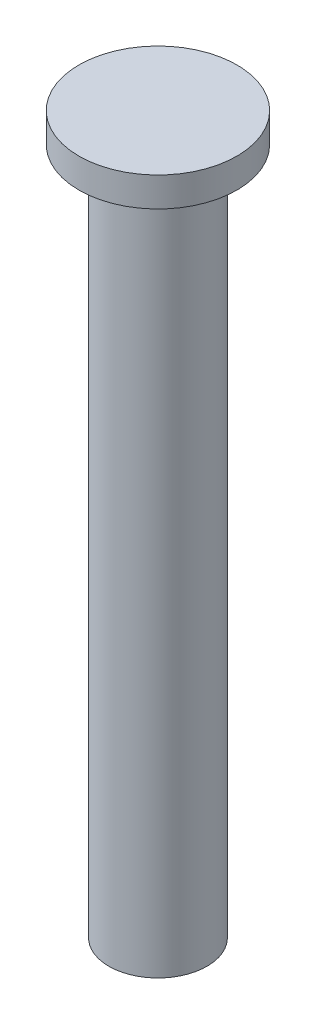
from build123d import *

# Parameters (mm, degrees)
SKETCH_1_R      = 2.5
EXTRUDE_1_DEPTH = 35
SKETCH_2_R      = 4.024551442
EXTRUDE_2_DEPTH = 1.5


with BuildPart() as part:
    # 草图1 → 凸台-拉伸1 (new body)
    with BuildSketch(Plane(origin=(0, 0, 0), x_dir=(1, 0, 0), z_dir=(0, 1, 0))):
        with Locations(Location((0, 0, 0), (0, 0, 270))):
            Circle(SKETCH_1_R)
    extrude(amount=EXTRUDE_1_DEPTH)

    # 草图2 → 凸台-拉伸2 (add)
    with BuildSketch(Plane(origin=(0, 35, 0), x_dir=(1, 0, 0), z_dir=(0, 1, 0))):
        with Locations(Location((0, 0, 0), (0, 0, 270))):
            Circle(SKETCH_2_R)
    extrude(amount=EXTRUDE_2_DEPTH)


solid = part.part
